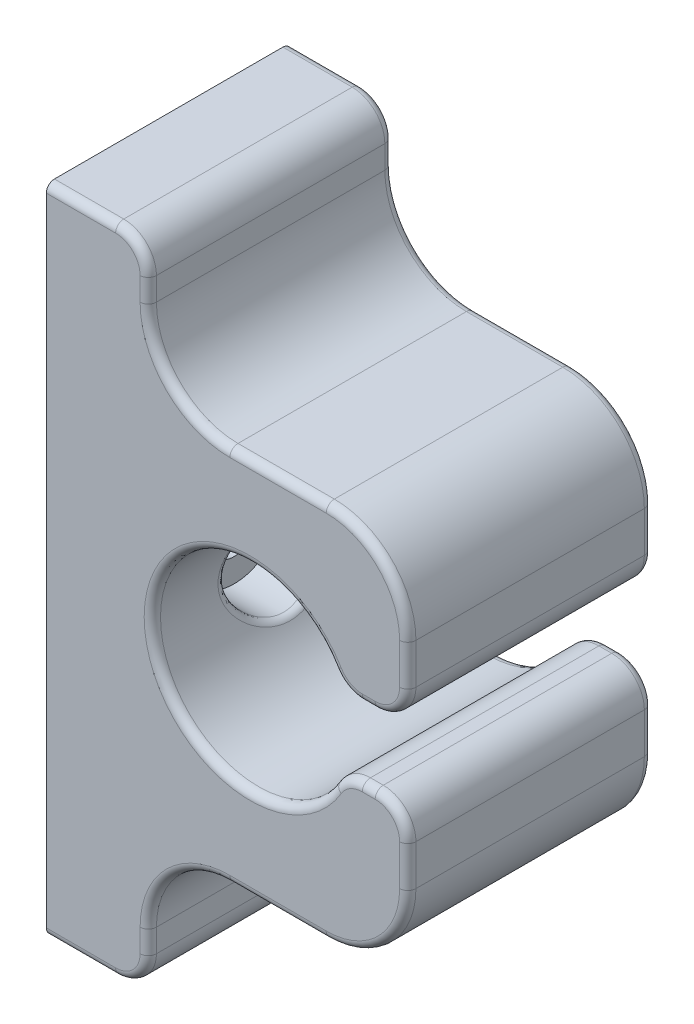
from build123d import *

# Parameters (mm, degrees)
BOSS_EXTRU_1_DEPTH           = 15
CONG_1_R                     = 0.5
ESQUISSE2_R                  = 1.55
ENL_V_MAT_EXTRU_1_DEPTH      = 15
ENL_V_MAT_EXTRU_2_DEPTH      = 3
ENL_V_MAT_EXTRU_2_DEPTH_BACK = 3
ESQUISSE3_R                  = 3
CONG_2_R                     = 0.5


with BuildPart() as part:
    # Esquisse1 → Boss.-Extru.1 (new body)
    with BuildSketch(Plane.XY):
        with BuildLine():
            Line((0, 0), (4.25, 0))
            ThreePointArc((4.25, 0), (5.664213562, 0.585786438), (6.25, 2))
            Line((6.25, 2), (6.25, 3.411816069))
            ThreePointArc((6.25, 3.411816069), (7.714466094, 6.947349975), (11.25, 8.411816069))
            Line((11.25, 8.411816069), (17.156372721, 8.411816069))
            ThreePointArc((17.156372721, 8.411816069), (20.691906627, 9.876282163), (22.156372721, 13.411816069))
            Line((22.156372721, 13.411816069), (22.156372721, 15.9))
            ThreePointArc((22.156372721, 15.9), (21.570586284, 17.314213562), (20.156372721, 17.9))
            Line((20.156372721, 17.9), (19.369497798, 17.9))
            ThreePointArc((19.369497798, 17.9), (18.382076915, 17.639252713), (17.652123349, 16.925))
            ThreePointArc((17.652123349, 16.925), (6.5, 20), (17.652123349, 23.075))
            ThreePointArc((17.652123349, 23.075), (18.382076915, 22.360747287), (19.369497798, 22.1))
            Line((19.369497798, 22.1), (20.156372721, 22.1))
            ThreePointArc((20.156372721, 22.1), (21.570586284, 22.685786438), (22.156372721, 24.1))
            Line((22.156372721, 24.1), (22.156372721, 26.588183931))
            ThreePointArc((22.156372721, 26.588183931), (20.691906627, 30.123717837), (17.156372721, 31.588183931))
            Line((17.156372721, 31.588183931), (11.25, 31.588183931))
            ThreePointArc((11.25, 31.588183931), (7.714466094, 33.052650025), (6.25, 36.588183931))
            Line((6.25, 36.588183931), (6.25, 38))
            ThreePointArc((6.25, 38), (5.664213562, 39.414213562), (4.25, 40))
            Line((4.25, 40), (0, 40))
            Line((0, 40), (0, 0))
        make_face()
    extrude(amount=BOSS_EXTRU_1_DEPTH)

    # Congé1
    cong_1_edges = [part.edges().sort_by_distance(p)[0] for p in [
        (5.664213562, 0.585786438, 15),
        (6.25, 2.705908034, 15),
        (7.714466094, 6.947349975, 15),
        (2.125, 40, 0),
        (5.664213562, 39.414213562, 0),
        (6.25, 37.294091966, 0),
        (7.714466094, 33.052650025, 0),
        (14.203186361, 31.588183931, 0),
        (20.691906627, 30.123717837, 0),
        (22.156372721, 25.344091966, 0),
        (21.570586284, 22.685786438, 0),
        (19.76293526, 22.1, 0),
        (18.382076915, 22.360747287, 0),
        (14.203186361, 8.411816069, 15),
        (6.5, 20, 0),
        (18.382076915, 17.639252713, 0),
        (19.76293526, 17.9, 0),
        (21.570586284, 17.314213562, 0),
        (22.156372721, 14.655908034, 0),
        (20.691906627, 9.876282163, 0),
        (14.203186361, 8.411816069, 0),
        (7.714466094, 6.947349975, 0),
        (6.25, 2.705908034, 0),
        (5.664213562, 0.585786438, 0),
        (20.691906627, 9.876282163, 15),
        (2.125, 0, 0),
        (22.156372721, 14.655908034, 15),
        (21.570586284, 17.314213562, 15),
        (19.76293526, 17.9, 15),
        (18.382076915, 17.639252713, 15),
        (6.5, 20, 15),
        (18.382076915, 22.360747287, 15),
        (19.76293526, 22.1, 15),
        (21.570586284, 22.685786438, 15),
        (22.156372721, 25.344091966, 15),
        (20.691906627, 30.123717837, 15),
        (14.203186361, 31.588183931, 15),
        (7.714466094, 33.052650025, 15),
        (6.25, 37.294091966, 15),
        (5.664213562, 39.414213562, 15),
        (2.125, 40, 15),
        (2.125, 0, 15),
    ]]
    fillet(cong_1_edges, radius=CONG_1_R)

    # Esquisse2 → Enlèv. mat.-Extru.1 (cut)
    with BuildSketch(Plane.ZY):
        with Locations((7.479977759, 20)):
            Circle(ESQUISSE2_R)
    extrude(amount=-ENL_V_MAT_EXTRU_1_DEPTH, mode=Mode.SUBTRACT)

    # Esquisse3 → Enlèv. mat.-Extru.2 (cut, two sides: drawn at the far end of the back side and taken through both)
    with BuildSketch(Plane.ZY.offset(-7).offset(-ENL_V_MAT_EXTRU_2_DEPTH_BACK)):
        with Locations((7.479977759, 20)):
            Circle(ESQUISSE3_R)
    extrude(amount=ENL_V_MAT_EXTRU_2_DEPTH + ENL_V_MAT_EXTRU_2_DEPTH_BACK, mode=Mode.SUBTRACT)

    # Congé2
    cong_2_edges = [part.edges().sort_by_distance(p)[0] for p in [
        (6.5, 20, 4.479977759),
    ]]
    fillet(cong_2_edges, radius=CONG_2_R)


solid = part.part
